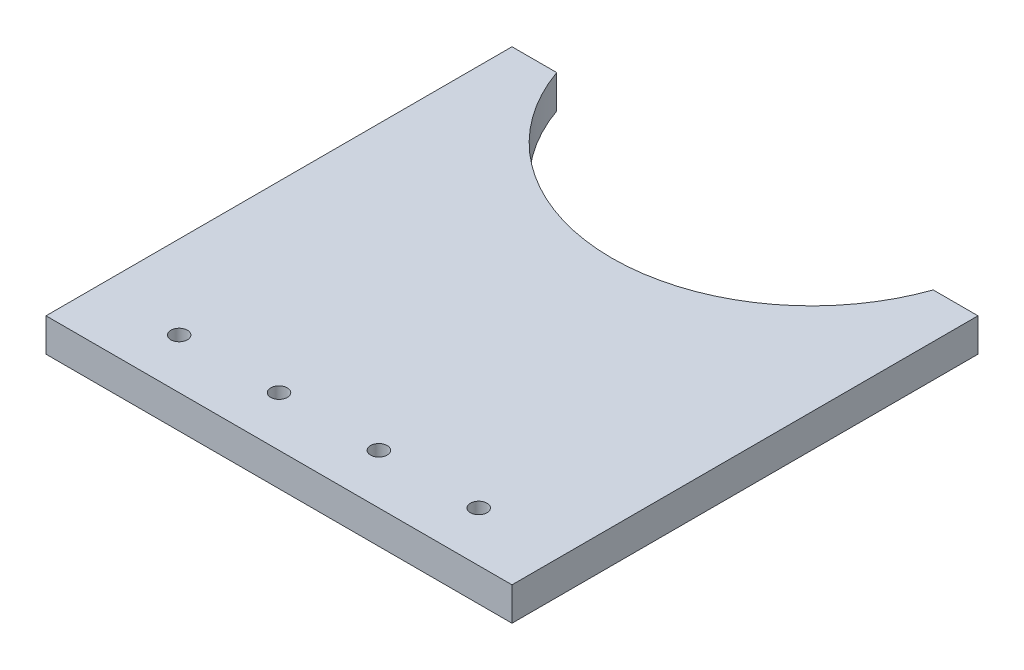
from build123d import *

# Parameters (mm, degrees)
BOSS_EXTRUDE1_DEPTH = 12.7
SKETCH2_R           = 3.175
CUT_EXTRUDE1_DEPTH  = 223.159267194


with BuildPart() as part:
    # Sketch1 → Boss-Extrude1 (new body)
    with BuildSketch(Plane(origin=(0, 0, 0), x_dir=(1, 0, 0), z_dir=(0, 1, 0))):
        with BuildLine():
            Line((-88.9, -25.4), (-71.842048969, -25.4))
            ThreePointArc((-71.842048969, -25.4), (0, -76.2), (71.842048969, -25.4))
            Line((71.842048969, -25.4), (88.9, -25.4))
            Line((88.9, -25.4), (88.9, -203.2))
            Line((88.9, -203.2), (-88.9, -203.2))
            Line((-88.9, -203.2), (-88.9, -25.4))
        make_face()
    extrude(amount=BOSS_EXTRUDE1_DEPTH)

    # Sketch2 → Cut-Extrude1 (cut, through all)
    with BuildSketch(Plane(origin=(0, 12.7, 0), x_dir=(1, 0, 0), z_dir=(0, 1, 0))):
        with Locations(Location((-19.05, -184.15, 0), (0, 0, 270))):
            Circle(SKETCH2_R)
        with Locations(Location((19.05, -184.15, 0), (0, 0, 270))):
            Circle(SKETCH2_R)
        with Locations(Location((57.15, -184.15, 0), (0, 0, 270))):
            Circle(SKETCH2_R)
        with Locations(Location((-57.15, -184.15, 0), (0, 0, 270))):
            Circle(SKETCH2_R)
    extrude(amount=-CUT_EXTRUDE1_DEPTH, mode=Mode.SUBTRACT)


solid = part.part
